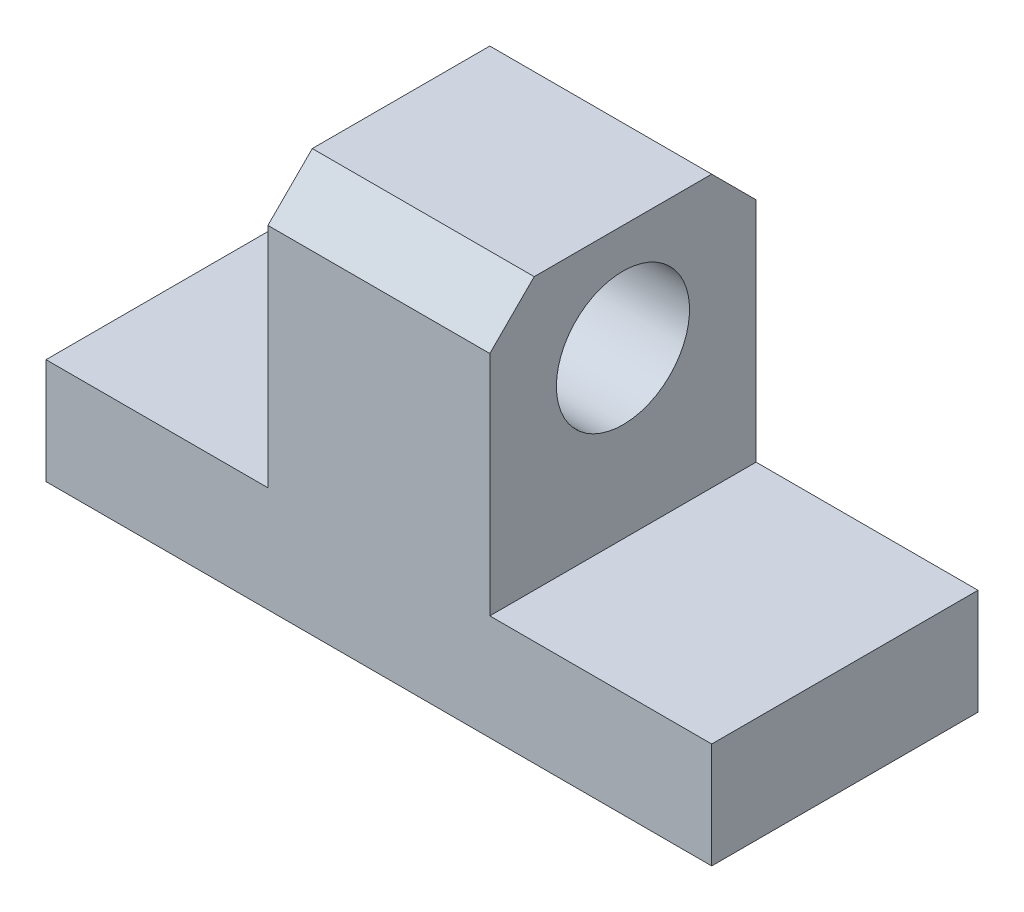
from build123d import *

# Parameters (mm, degrees)
EXTRUDE_2_DEPTH     = 12
CHAMFER_1_SIZE      = 2
SKETCH_4_R          = 3
CUT_EXTRUDE_4_DEPTH = 29.861739379


with BuildPart() as part:
    # Эскиз2 → Вытянуть2 (new body)
    with BuildSketch(Plane.XY):
        Polygon((0.846446281, 0), (-29.153553719, 0), (-29.153553719, 4.760108812), (-19.153553719, 4.760108812), (-19.153553719, 17), (-9.153553719, 17), (-9.153553719, 4.760108812), (0.846446281, 4.760108812), align=None)
    extrude(amount=EXTRUDE_2_DEPTH)

    # Фаска1
    chamfer_1_edges = [part.edges().sort_by_distance(p)[0] for p in [
        (-14.153553719, 17, 12),
        (-14.153553719, 17, 0),
    ]]
    chamfer(chamfer_1_edges, length=CHAMFER_1_SIZE)

    # Эскиз4 → Вытянуть4 (cut, through all)
    with BuildSketch(Plane.ZY.offset(19.153553719)):
        with Locations((6, 12.217021039)):
            Circle(SKETCH_4_R)
    extrude(amount=-CUT_EXTRUDE_4_DEPTH, mode=Mode.SUBTRACT)


solid = part.part
